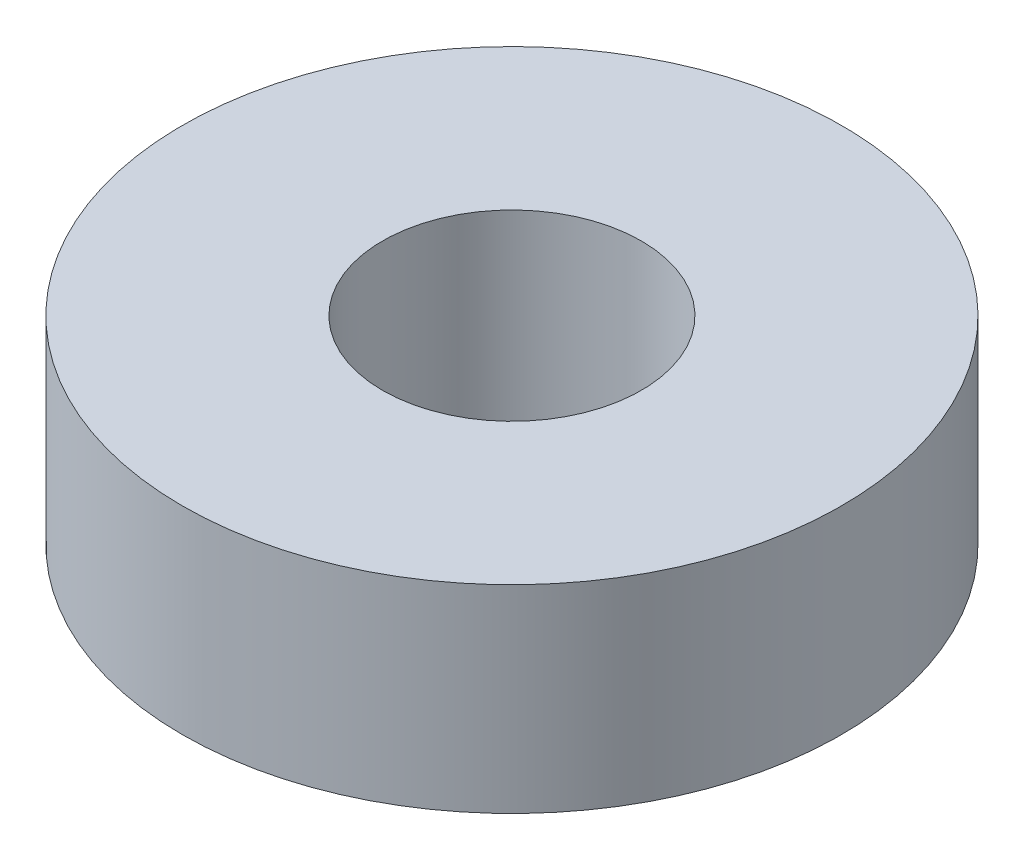
from build123d import *

# Parameters (mm, degrees)
SKETCH1_R           = 9.9
SKETCH1_R_2         = 4
BOSS_EXTRUDE1_DEPTH = 6
MOVE_FACE1_BY       = 0.08
MOVE_FACE1_2_BY     = 0.08


with BuildPart() as part:
    # Sketch1 → Boss-Extrude1 (new body)
    with BuildSketch(Plane(origin=(0, 0, 0), x_dir=(1, 0, 0), z_dir=(0, 1, 0))):
        with Locations(Location((0, 0, 0), (0, 0, 270))):
            Circle(SKETCH1_R)
        with Locations(Location((0, 0, 0), (0, 0, 270))):
            Circle(SKETCH1_R_2, mode=Mode.SUBTRACT)
    extrude(amount=BOSS_EXTRUDE1_DEPTH)

    # Move Face1: a curved face moved outward by 0.08
    add(Solid.thicken(part.faces().sort_by_distance((0, 3, -9.9))[0], MOVE_FACE1_BY))

    # Move Face1 2: a curved face moved outward by 0.08
    add(Solid.thicken(part.faces().sort_by_distance((0, 3, -4))[0], MOVE_FACE1_2_BY))


solid = part.part
